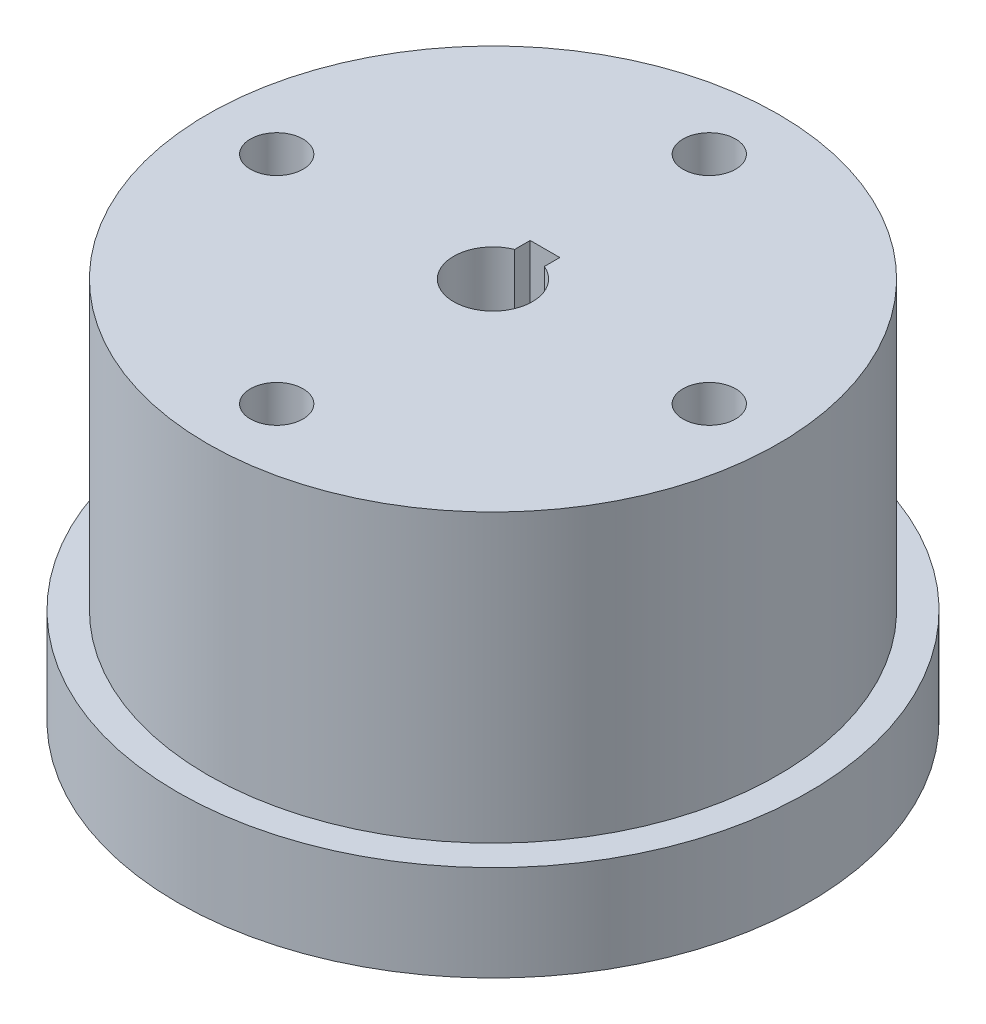
from build123d import *

# Parameters (mm, degrees)
SKETCH1_R           = 33
BOSS_EXTRUDE1_DEPTH = 10
SKETCH2_R           = 29.86
BOSS_EXTRUDE2_DEPTH = 30
CUT_EXTRUDE1_DEPTH  = 54
SKETCH4_R           = 4.12
CUT_EXTRUDE2_DEPTH  = 54


with BuildPart() as part:
    # Sketch1 → Boss-Extrude1 (new body)
    with BuildSketch(Plane(origin=(0, 0, 0), x_dir=(1, 0, 0), z_dir=(0, 1, 0))):
        with Locations(Location((0, 0, 0), (0, 0, 270))):
            Circle(SKETCH1_R)
    extrude(amount=BOSS_EXTRUDE1_DEPTH)

    # Sketch2 → Boss-Extrude2 (add)
    with BuildSketch(Plane(origin=(0, 10, 0), x_dir=(1, 0, 0), z_dir=(0, 1, 0))):
        with Locations(Location((0, 0, 0), (0, 0, 270))):
            Circle(SKETCH2_R)
    extrude(amount=BOSS_EXTRUDE2_DEPTH)

    # Sketch3 → Cut-Extrude1 (cut)
    with BuildSketch(Plane(origin=(0, 40, 0), x_dir=(1, 0, 0), z_dir=(0, 1, 0))):
        with BuildLine():
            Line((1.944543648, 20.68287335), (0, 22.627416998))
            Line((0, 22.627416998), (-1.944543648, 20.68287335))
            ThreePointArc((-1.944543648, 20.68287335), (0, 19.877416998), (1.944543648, 20.68287335))
        make_face()
        with BuildLine():
            Line((-1.944543648, 20.68287335), (0, 22.627416998))
            Line((0, 22.627416998), (1.944543648, 20.68287335))
            ThreePointArc((1.944543648, 20.68287335), (2.540668714, 21.575037559), (2.75, 22.627416998))
            ThreePointArc((2.75, 22.627416998), (-1.052379439, 25.168085712), (-1.944543648, 20.68287335))
        make_face()
        with BuildLine():
            ThreePointArc((25.377416998, 0), (23.679796437, 2.540668714), (20.68287335, 1.944543648))
            Line((20.68287335, 1.944543648), (22.627416998, 0))
            Line((22.627416998, 0), (20.68287335, -1.944543648))
            ThreePointArc((20.68287335, -1.944543648), (23.679796437, -2.540668714), (25.377416998, 0))
        make_face()
        with BuildLine():
            Line((22.627416998, 0), (20.68287335, 1.944543648))
            ThreePointArc((20.68287335, 1.944543648), (19.877416998, 0), (20.68287335, -1.944543648))
            Line((20.68287335, -1.944543648), (22.627416998, 0))
        make_face()
        with BuildLine():
            ThreePointArc((1.944543648, -20.68287335), (0, -19.877416998), (-1.944543648, -20.68287335))
            Line((-1.944543648, -20.68287335), (0, -22.627416998))
            Line((0, -22.627416998), (1.944543648, -20.68287335))
        make_face()
        with BuildLine():
            Line((0, -22.627416998), (-1.944543648, -20.68287335))
            ThreePointArc((-1.944543648, -20.68287335), (-1.052379439, -25.168085712), (2.75, -22.627416998))
            ThreePointArc((2.75, -22.627416998), (2.540668714, -21.575037559), (1.944543648, -20.68287335))
            Line((1.944543648, -20.68287335), (0, -22.627416998))
        make_face()
        with BuildLine():
            ThreePointArc((-19.877416998, 0), (-20.086748284, 1.052379439), (-20.68287335, 1.944543648))
            Line((-20.68287335, 1.944543648), (-22.627416998, 0))
            Line((-22.627416998, 0), (-20.68287335, -1.944543648))
            ThreePointArc((-20.68287335, -1.944543648), (-20.086748284, -1.052379439), (-19.877416998, 0))
        make_face()
        with BuildLine():
            Line((-22.627416998, 0), (-20.68287335, 1.944543648))
            ThreePointArc((-20.68287335, 1.944543648), (-25.377416998, 0), (-20.68287335, -1.944543648))
            Line((-20.68287335, -1.944543648), (-22.627416998, 0))
        make_face()
    extrude(amount=-CUT_EXTRUDE1_DEPTH, mode=Mode.SUBTRACT)

    # Sketch4 → Cut-Extrude2 (cut)
    with BuildSketch(Plane(origin=(0, 40, 0), x_dir=(1, 0, 0), z_dir=(0, 1, 0))):
        Circle(SKETCH4_R)
        with BuildLine():
            Line((0, 5.44), (0, 4.12))
            ThreePointArc((0, 4.12), (0.789638797, 4.043620973), (1.55, 3.817315811))
            Line((1.55, 3.817315811), (1.55, 5.44))
            Line((1.55, 5.44), (0, 5.44))
        make_face()
        with BuildLine():
            ThreePointArc((-1.55, 3.817315811), (-0.789638797, 4.043620973), (0, 4.12))
            Line((0, 4.12), (0, 5.44))
            Line((0, 5.44), (-1.55, 5.44))
            Line((-1.55, 5.44), (-1.55, 3.817315811))
        make_face()
    extrude(amount=-CUT_EXTRUDE2_DEPTH, mode=Mode.SUBTRACT)


solid = part.part
